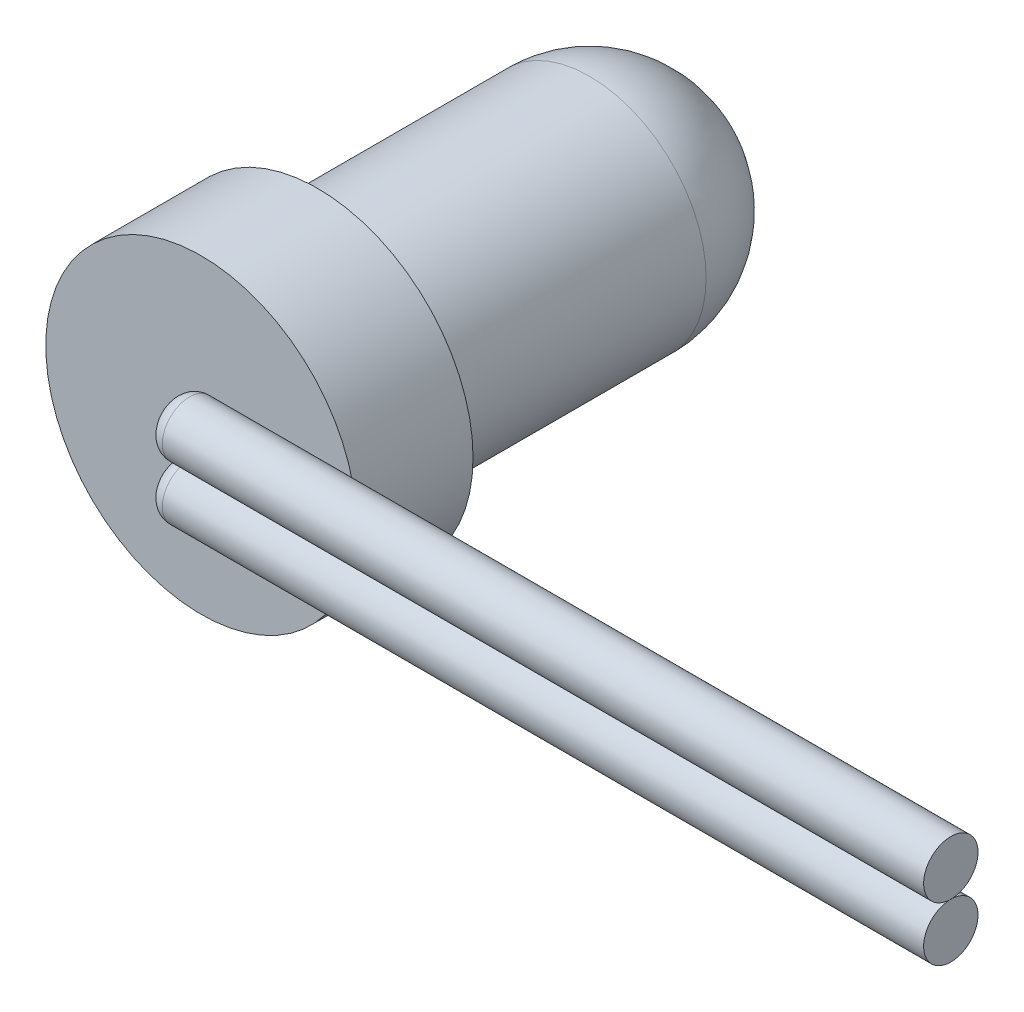
from build123d import *

# Parameters (mm, degrees)
SKETCH1_R        = 1.5
EXTRUDE1_DEPTH   = 5
SKETCH2_R        = 2
EXTRUDE2_DEPTH   = 1.5
FILLET1_R        = 1.5
SKETCH3_R        = 0.35
EXTRUDE3_DEPTH   = 10
EXTRUDE3_2_DEPTH = 10
FILLET2_R        = 0.2
FILLET3_R        = 0.2


with BuildPart() as part:
    # Sketch1 → Extrude1 (new body)
    with BuildSketch(Plane.XY):
        Circle(SKETCH1_R)
    extrude(amount=EXTRUDE1_DEPTH)

    # Sketch2 → Extrude2 (add)
    with BuildSketch(Plane.XY.offset(5)):
        Circle(SKETCH2_R)
    extrude(amount=EXTRUDE2_DEPTH)

    # Fillet1
    fillet1_edges = [part.edges().sort_by_distance(p)[0] for p in [
        (-1.5, 0, 0),
    ]]
    fillet(fillet1_edges, radius=FILLET1_R)


with BuildPart() as body_2:
    # Sketch3 → Extrude3 (new body)
    with BuildSketch(Plane(origin=(0, 0, 0), x_dir=(0, 0, -1), z_dir=(1, 0, 0))):
        with Locations((-6.85, -0.35)):
            Circle(SKETCH3_R)
    extrude(amount=EXTRUDE3_DEPTH)

    # Fillet2
    fillet2_edges = [body_2.edges().sort_by_distance(p)[0] for p in [
        (0, -0.35, 7.2),
    ]]
    fillet(fillet2_edges, radius=FILLET2_R)


with BuildPart() as body_3:
    # Sketch3 → Extrude3 2 (new body)
    with BuildSketch(Plane(origin=(0, 0, 0), x_dir=(0, 0, -1), z_dir=(1, 0, 0))):
        with Locations((-6.85, 0.35)):
            Circle(SKETCH3_R)
    extrude(amount=EXTRUDE3_2_DEPTH)

    # Fillet3
    fillet3_edges = [body_3.edges().sort_by_distance(p)[0] for p in [
        (0, 0.35, 7.2),
    ]]
    fillet(fillet3_edges, radius=FILLET3_R)


solid = Compound([part.part, body_2.part, body_3.part])
